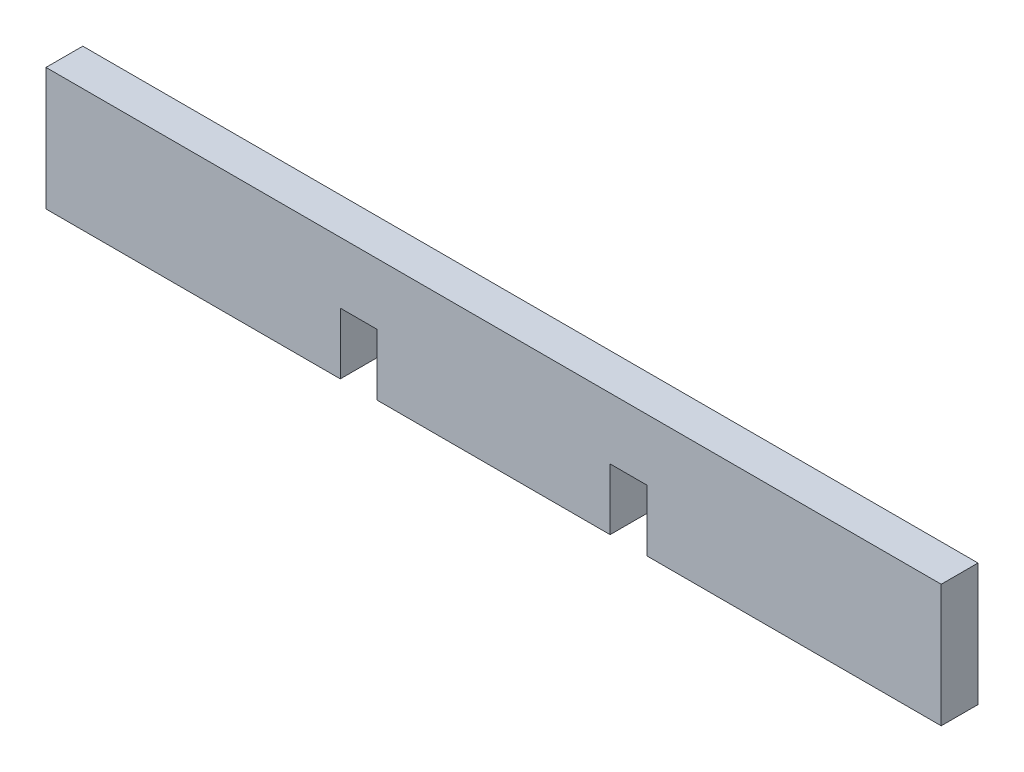
from build123d import *

# Parameters (mm, degrees)
BOSS_EXTRUDE1_DEPTH = 3


with BuildPart() as part:
    # Sketch1 → Boss-Extrude1 (new body)
    with BuildSketch(Plane.XY):
        Polygon((-4.092307692, 0), (5.85, 0), (5.85, 5), (8.85, 5), (8.85, 0), (32.85, 0), (32.85, 10), (-40.15, 10), (-40.15, 0), (-16.15, 0), (-16.15, 5), (-13.15, 5), (-13.15, 0), align=None)
    extrude(amount=BOSS_EXTRUDE1_DEPTH)


solid = part.part
